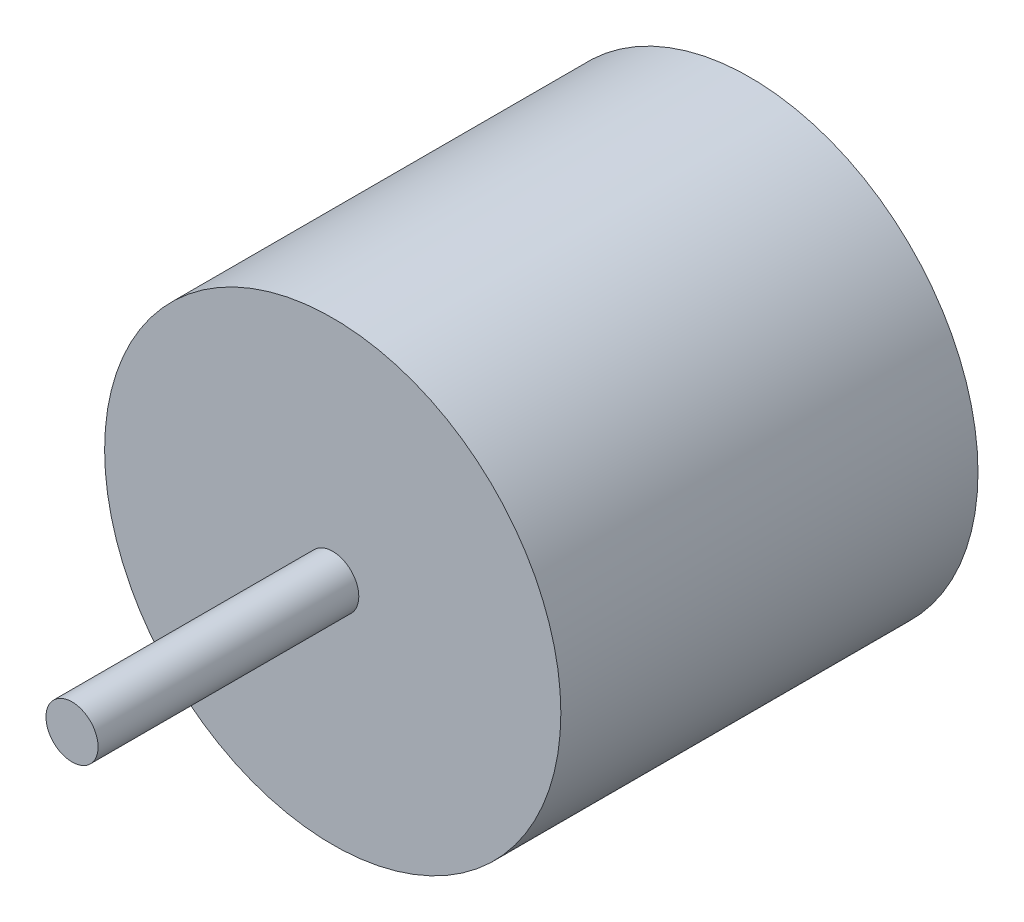
from build123d import *

# Parameters (mm, degrees)
ESQUISSE1_R        = 17.5
BOSS_EXTRU_1_DEPTH = 32
ESQUISSE2_R        = 2
BOSS_EXTRU_2_DEPTH = 20


with BuildPart() as part:
    # Esquisse1 → Boss.-Extru.1 (new body)
    with BuildSketch(Plane.XY):
        Circle(ESQUISSE1_R)
    extrude(amount=BOSS_EXTRU_1_DEPTH)

    # Esquisse2 → Boss.-Extru.2 (add)
    with BuildSketch(Plane.XY.offset(32)):
        Circle(ESQUISSE2_R)
    extrude(amount=BOSS_EXTRU_2_DEPTH)


solid = part.part
